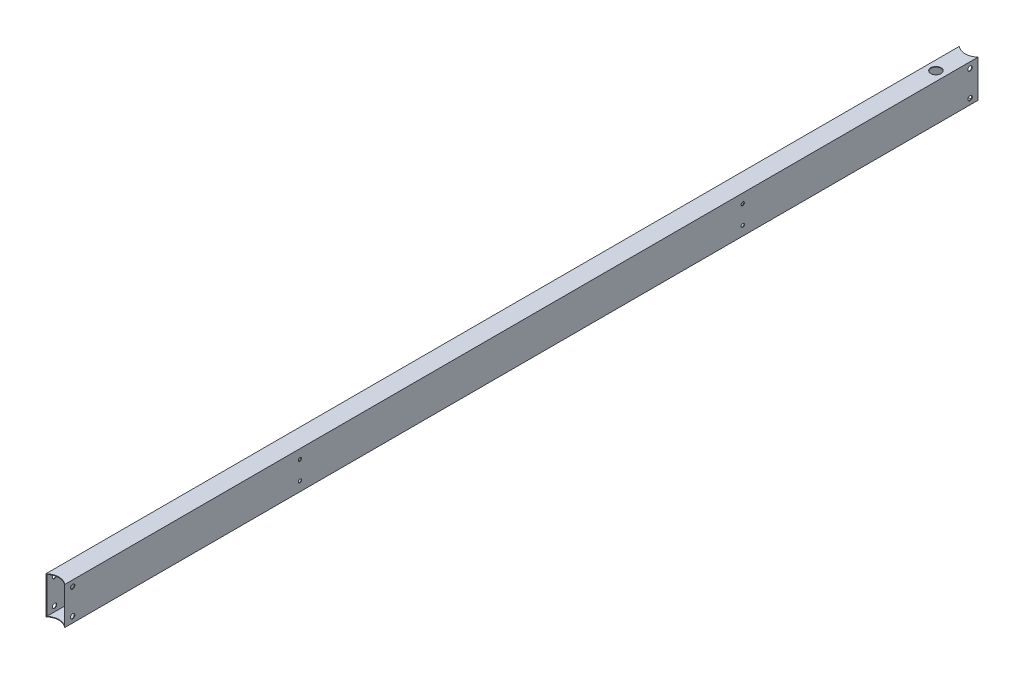
from build123d import *

# Parameters (mm, degrees)
SKETCH1_W           = 40
SKETCH1_H           = 80
SKETCH1_W_2         = 37.6
SKETCH1_H_2         = 77.6
BOSS_EXTRUDE1_DEPTH = 1955
SKETCH2_R           = 11
CUT_EXTRUDE1_DEPTH  = 1955
SKETCH3_R           = 4.75
CUT_EXTRUDE2_DEPTH  = 1958.044966269
SKETCH4_R           = 3.5
CUT_EXTRUDE3_DEPTH  = 1958.044966269


with BuildPart() as part:
    # Sketch1 → Boss-Extrude1 (new body)
    with BuildSketch(Plane.XY):
        with Locations((20, 40)):
            Rectangle(SKETCH1_W, SKETCH1_H)
        with Locations((20, 40)):
            Rectangle(SKETCH1_W_2, SKETCH1_H_2, mode=Mode.SUBTRACT)
    extrude(amount=BOSS_EXTRUDE1_DEPTH)

    # Sketch2 → Cut-Extrude1 (cut)
    with BuildSketch(Plane(origin=(0, 80, 0), x_dir=(1, 0, 0), z_dir=(0, 1, 0))):
        with Locations(Location((20, -70, 0), (0, 0, 270))):
            Circle(SKETCH2_R)
        with BuildLine():
            Line((0, 0), (40, 0))
            ThreePointArc((40, 0), (20, -7.639320225), (0, 0))
        make_face()
        with BuildLine():
            Line((0, -1955), (40, -1955))
            ThreePointArc((40, -1955), (20, -1947.360679775), (0, -1955))
        make_face()
    extrude(amount=-CUT_EXTRUDE1_DEPTH, mode=Mode.SUBTRACT)

    # Sketch3 → Cut-Extrude2 (cut, through all)
    with BuildSketch(Plane(origin=(40, 0, 0), x_dir=(0, 0, -1), z_dir=(1, 0, 0))):
        with Locations((-17, 67.5)):
            Circle(SKETCH3_R)
        with Locations((-17, 12.5)):
            Circle(SKETCH3_R)
        with Locations((-1938, 67.5)):
            Circle(SKETCH3_R)
        with Locations((-1938, 12.5)):
            Circle(SKETCH3_R)
    extrude(amount=-CUT_EXTRUDE2_DEPTH, mode=Mode.SUBTRACT)

    # Sketch4 → Cut-Extrude3 (cut, through all)
    with BuildSketch(Plane(origin=(40, 0, 0), x_dir=(0, 0, -1), z_dir=(1, 0, 0))):
        with Locations((-1451.5, 60)):
            Circle(SKETCH4_R)
        with Locations((-1451.5, 20)):
            Circle(SKETCH4_R)
        with Locations((-503.5, 60)):
            Circle(SKETCH4_R)
        with Locations((-503.5, 20)):
            Circle(SKETCH4_R)
    extrude(amount=-CUT_EXTRUDE3_DEPTH, mode=Mode.SUBTRACT)


solid = part.part
